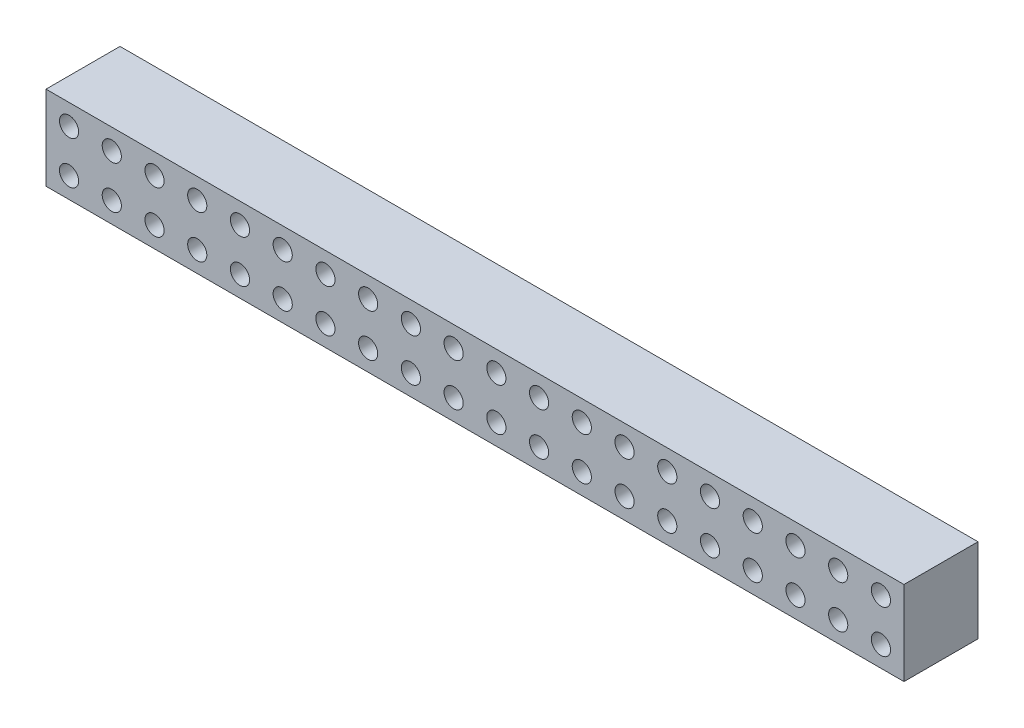
from build123d import *

# Parameters (mm, degrees)
CROQUIS1_W              = 51
CROQUIS1_H              = 5
SALIENTE_EXTRUIR1_DEPTH = 4.4
CROQUIS2_R              = 0.57
CORTAR_EXTRUIR1_DEPTH   = 26.997307553


with BuildPart() as part:
    # Croquis1 → Saliente-Extruir1 (new body)
    with BuildSketch(Plane.XY):
        Rectangle(CROQUIS1_W, CROQUIS1_H)
    extrude(amount=SALIENTE_EXTRUIR1_DEPTH)

    # Croquis2 → Cortar-Extruir1 (cut, through all)
    with BuildSketch(Plane.XY.offset(4.4)):
        with Locations((-24.13, 1.27)):
            Circle(CROQUIS2_R)
        with Locations((-21.59, 1.27)):
            Circle(CROQUIS2_R)
        with Locations((-19.05, 1.27)):
            Circle(CROQUIS2_R)
        with Locations((-16.51, 1.27)):
            Circle(CROQUIS2_R)
        with Locations((-13.97, 1.27)):
            Circle(CROQUIS2_R)
        with Locations((-11.43, 1.27)):
            Circle(CROQUIS2_R)
        with Locations((-8.89, 1.27)):
            Circle(CROQUIS2_R)
        with Locations((-6.35, 1.27)):
            Circle(CROQUIS2_R)
        with Locations((-3.81, 1.27)):
            Circle(CROQUIS2_R)
        with Locations((-1.27, 1.27)):
            Circle(CROQUIS2_R)
        with Locations((1.27, 1.27)):
            Circle(CROQUIS2_R)
        with Locations((3.81, 1.27)):
            Circle(CROQUIS2_R)
        with Locations((6.35, 1.27)):
            Circle(CROQUIS2_R)
        with Locations((8.89, 1.27)):
            Circle(CROQUIS2_R)
        with Locations((11.43, 1.27)):
            Circle(CROQUIS2_R)
        with Locations((13.97, 1.27)):
            Circle(CROQUIS2_R)
        with Locations((16.51, 1.27)):
            Circle(CROQUIS2_R)
        with Locations((19.05, 1.27)):
            Circle(CROQUIS2_R)
        with Locations((21.59, 1.27)):
            Circle(CROQUIS2_R)
        with Locations((24.13, 1.27)):
            Circle(CROQUIS2_R)
        with Locations((-21.59, -1.27)):
            Circle(CROQUIS2_R)
        with Locations((-19.05, -1.27)):
            Circle(CROQUIS2_R)
        with Locations((-16.51, -1.27)):
            Circle(CROQUIS2_R)
        with Locations((-13.97, -1.27)):
            Circle(CROQUIS2_R)
        with Locations((-11.43, -1.27)):
            Circle(CROQUIS2_R)
        with Locations((-8.89, -1.27)):
            Circle(CROQUIS2_R)
        with Locations((-6.35, -1.27)):
            Circle(CROQUIS2_R)
        with Locations((-3.81, -1.27)):
            Circle(CROQUIS2_R)
        with Locations((-1.27, -1.27)):
            Circle(CROQUIS2_R)
        with Locations((1.27, -1.27)):
            Circle(CROQUIS2_R)
        with Locations((3.81, -1.27)):
            Circle(CROQUIS2_R)
        with Locations((6.35, -1.27)):
            Circle(CROQUIS2_R)
        with Locations((8.89, -1.27)):
            Circle(CROQUIS2_R)
        with Locations((11.43, -1.27)):
            Circle(CROQUIS2_R)
        with Locations((13.97, -1.27)):
            Circle(CROQUIS2_R)
        with Locations((16.51, -1.27)):
            Circle(CROQUIS2_R)
        with Locations((19.05, -1.27)):
            Circle(CROQUIS2_R)
        with Locations((21.59, -1.27)):
            Circle(CROQUIS2_R)
        with Locations((24.13, -1.27)):
            Circle(CROQUIS2_R)
        with Locations((-24.13, -1.27)):
            Circle(CROQUIS2_R)
    extrude(amount=-CORTAR_EXTRUIR1_DEPTH, mode=Mode.SUBTRACT)


solid = part.part
